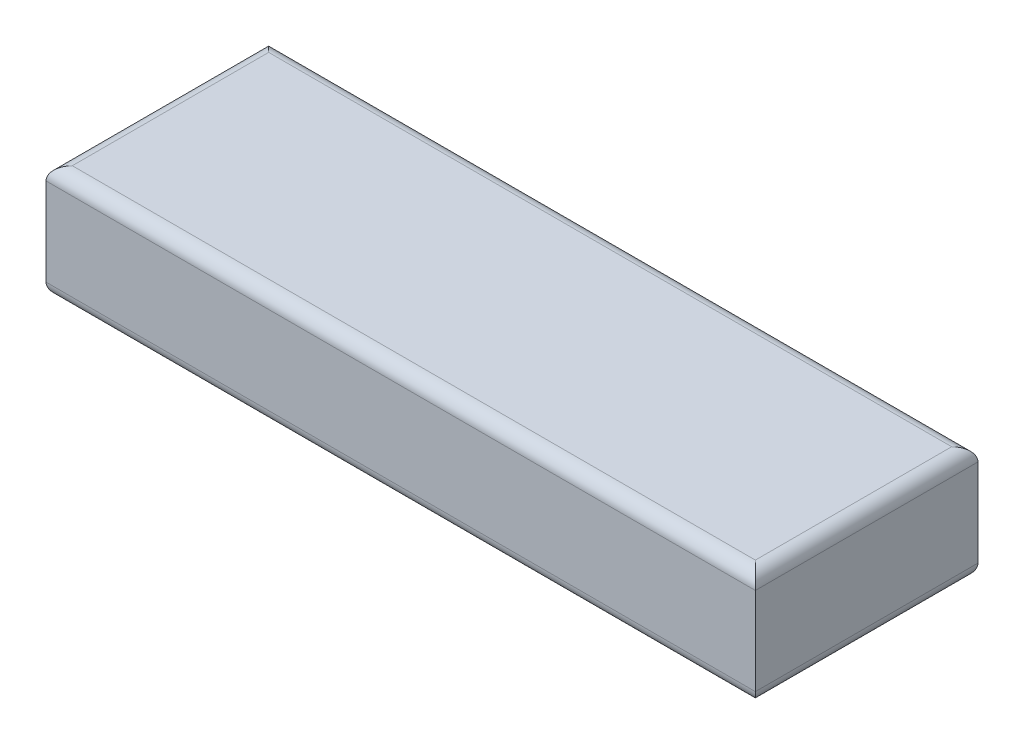
from build123d import *

# Parameters (mm, degrees)
SKETCH1_W           = 137
SKETCH1_H           = 43
BOSS_EXTRUDE1_DEPTH = 22
FILLET1_R           = 2.54


with BuildPart() as part:
    # Sketch1 → Boss-Extrude1 (new body)
    with BuildSketch(Plane(origin=(0, 0, 0), x_dir=(1, 0, 0), z_dir=(0, 1, 0))):
        with Locations((65.793650794, -30.914819758)):
            Rectangle(SKETCH1_W, SKETCH1_H)
    extrude(amount=BOSS_EXTRUDE1_DEPTH)

    # Fillet1
    fillet1_edges = [part.edges().sort_by_distance(p)[0] for p in [
        (134.293650794, 22, 30.914819758),
        (65.793650794, 22, 9.414819758),
        (-2.706349206, 22, 30.914819758),
        (65.793650794, 0, 9.414819758),
        (134.293650794, 0, 30.914819758),
        (65.793650794, 0, 52.414819758),
        (-2.706349206, 0, 30.914819758),
        (65.793650794, 22, 52.414819758),
    ]]
    fillet(fillet1_edges, radius=FILLET1_R)


solid = part.part
